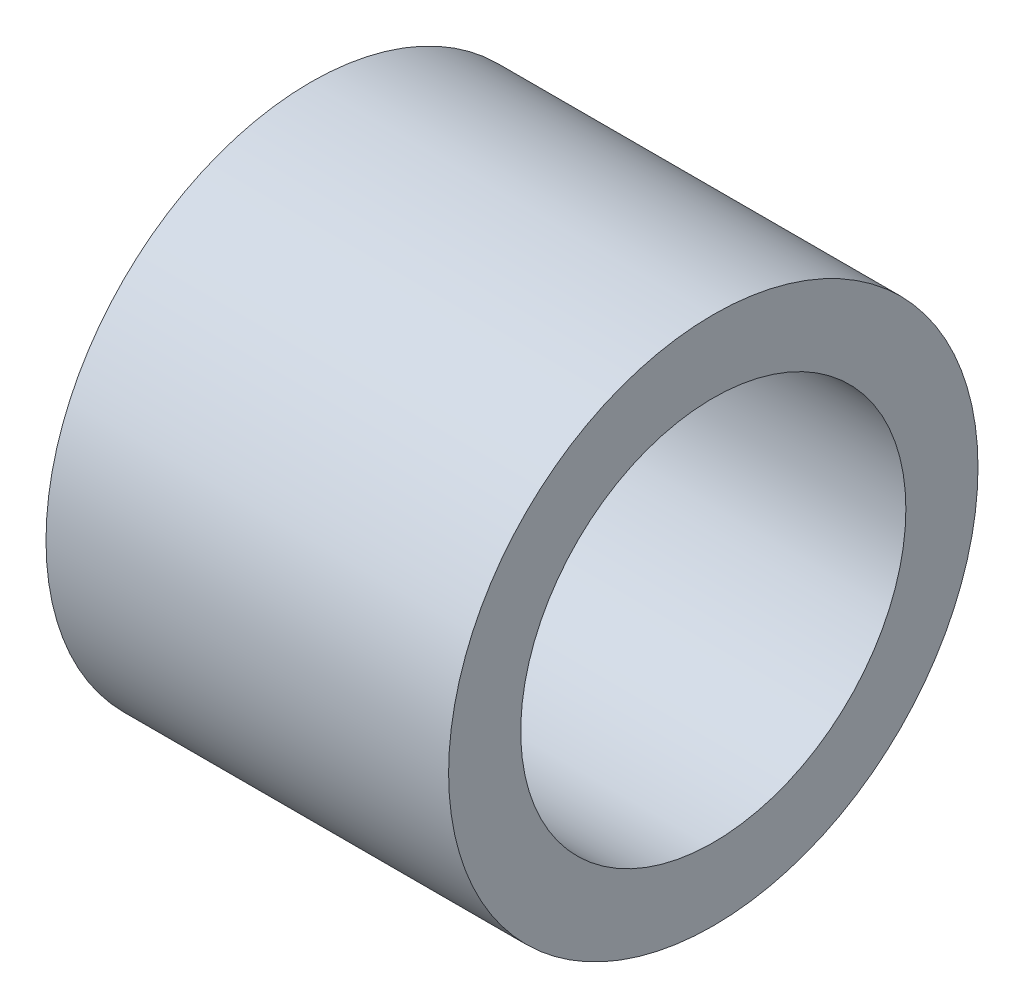
from build123d import *

# Parameters (mm, degrees)
CROQUIS1_R              = 16.7
CROQUIS1_R_2            = 12.15
SALIENTE_EXTRUIR1_DEPTH = 25.4


with BuildPart() as part:
    # Croquis1 → Saliente-Extruir1 (new body)
    with BuildSketch(Plane(origin=(0, 0, 0), x_dir=(0, 0, -1), z_dir=(1, 0, 0))):
        Circle(CROQUIS1_R)
        Circle(CROQUIS1_R_2, mode=Mode.SUBTRACT)
    extrude(amount=SALIENTE_EXTRUIR1_DEPTH)


solid = part.part
